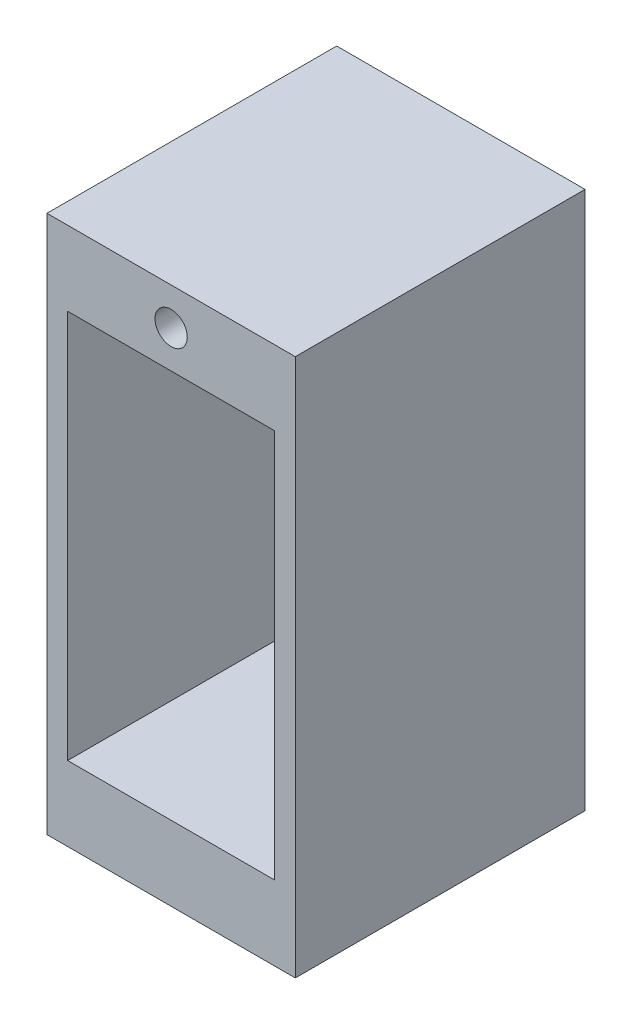
from build123d import *

# Parameters (mm, degrees)
SKETCH2_W           = 15
SKETCH2_H           = 32.5
BOSS_EXTRUDE1_DEPTH = 17.5
SKETCH3_W           = 12.5
SKETCH3_H           = 23.5
CUT_EXTRUDE1_DEPTH  = 17.5
SKETCH5_R           = 0.975
CUT_EXTRUDE2_DEPTH  = 8


with BuildPart() as part:
    # Sketch2 → Boss-Extrude1 (new body)
    with BuildSketch(Plane.XY):
        with Locations((-16.112359551, -1.991573034)):
            Rectangle(SKETCH2_W, SKETCH2_H)
    extrude(amount=BOSS_EXTRUDE1_DEPTH)

    # Sketch3 → Cut-Extrude1 (cut)
    with BuildSketch(Plane(origin=(0, 0, 0), x_dir=(-1, 0, 0), z_dir=(0, 0, -1))):
        with Locations((16.112359551, -1.991573034)):
            Rectangle(SKETCH3_W, SKETCH3_H)
    extrude(amount=-CUT_EXTRUDE1_DEPTH, mode=Mode.SUBTRACT)

    # Sketch5 → Cut-Extrude2 (cut)
    with BuildSketch(Plane.XY.offset(17.5)):
        with Locations((-16.112359551, 12.008426966)):
            Circle(SKETCH5_R)
    extrude(amount=-CUT_EXTRUDE2_DEPTH, mode=Mode.SUBTRACT)


solid = part.part
